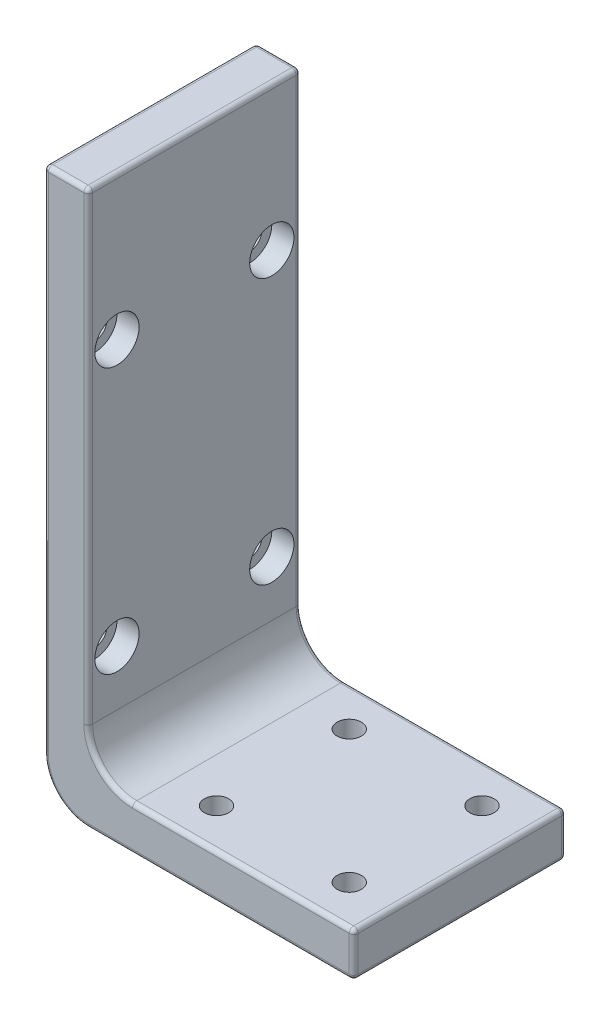
from build123d import *

# Parameters (mm, degrees)
BASE_DEPTH                           = 48
ROOT_EDGE_FILLET_R                   = 10
SLIDER_BOLT_HOLE_PATTERN_D           = 5.5
SLIDER_BOLT_HOLE_PATTERN_CBORE_D     = 10
SLIDER_BOLT_HOLE_PATTERN_CBORE_DEPTH = 5
DESKTOP_BOLT_HOLE_PATTERN_D          = 5.5
EXTERNAL_FILLET_R                    = 1


with BuildPart() as part:
    # Sketch1 → base (new body)
    with BuildSketch(Plane.XY):
        Polygon((0, 125), (0, 0), (70, 0), (70, 10), (10, 10), (10, 125), align=None)
    extrude(amount=BASE_DEPTH)

    # root_edge_fillet
    root_edge_fillet_edges = [part.edges().sort_by_distance(p)[0] for p in [
        (10, 10, 24),
        (0, 0, 24),
    ]]
    fillet(root_edge_fillet_edges, radius=ROOT_EDGE_FILLET_R)

    # slider_bolt_hole_pattern (through all)
    with Locations(Plane(origin=(10, 0, 0), x_dir=(0, 0, -1), z_dir=(1, 0, 0))):
        with Locations((-41.5, 92.5), (-6.5, 32.5), (-41.5, 32.5), (-6.5, 92.5)):
            CounterBoreHole(SLIDER_BOLT_HOLE_PATTERN_D / 2, SLIDER_BOLT_HOLE_PATTERN_CBORE_D / 2, SLIDER_BOLT_HOLE_PATTERN_CBORE_DEPTH)

    # desktop_bolt_hole_pattern (through all)
    with Locations(Plane(origin=(0, 10, 0), x_dir=(1, 0, 0), z_dir=(0, 1, 0))):
        with Locations((30, -9), (60, -39), (30, -39), (60, -9)):
            Hole(DESKTOP_BOLT_HOLE_PATTERN_D / 2)

    # external_fillet
    external_fillet_edges = [part.edges().sort_by_distance(p)[0] for p in [
        (10, 125, 24),
        (70, 10, 24),
        (70, 0, 24),
        (0, 125, 24),
        (70, 5, 48),
        (45, 10, 48),
        (40, 0, 0),
        (40, 0, 48),
        (10, 72.5, 0),
        (2.928932188, 2.928932188, 0),
        (10, 72.5, 48),
        (2.928932188, 2.928932188, 48),
        (12.928932188, 12.928932188, 0),
        (12.928932188, 12.928932188, 48),
        (5, 125, 48),
        (45, 10, 0),
        (70, 5, 0),
        (0, 67.5, 48),
        (0, 67.5, 0),
        (5, 125, 0),
    ]]
    fillet(external_fillet_edges, radius=EXTERNAL_FILLET_R)


solid = part.part
